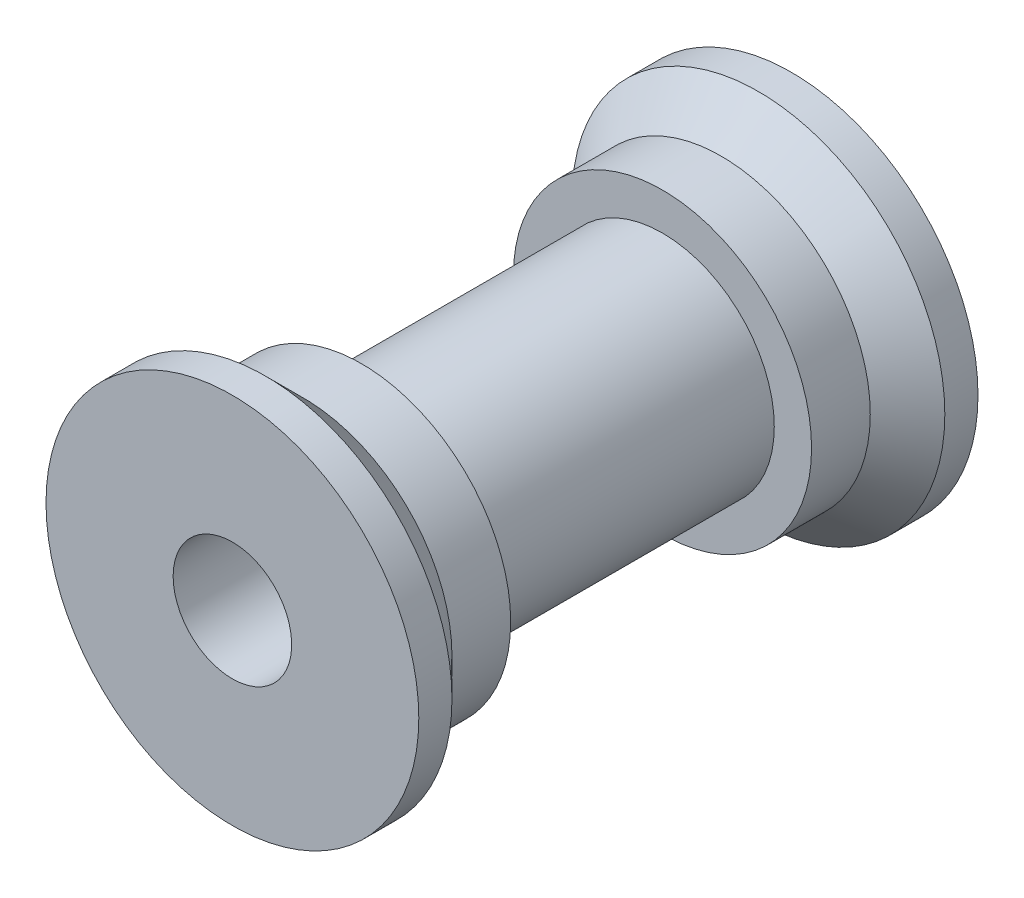
from build123d import *

# Parameters (mm, degrees)
SKETCH1_R           = 12.7
SKETCH1_R_2         = 4.0386
BOSS_EXTRUDE1_DEPTH = 38.1


with BuildPart() as part:
    # Sketch1 → Boss-Extrude1 (new body)
    with BuildSketch(Plane.XY):
        with Locations(Location((0, 0, 0), (0, 0, 180))):
            Circle(SKETCH1_R)
        with Locations(Location((0, 0, 0), (0, 0, 180))):
            Circle(SKETCH1_R_2, mode=Mode.SUBTRACT)
    extrude(amount=BOSS_EXTRUDE1_DEPTH)

    # Sketch2 → Cut-Revolve1 (revolve, cut)
    with BuildSketch(Plane(origin=(0, 0, 0), x_dir=(1, 0, 0), z_dir=(0, 1, 0)), mode=Mode.PRIVATE) as cut_revolve1_sk:
        Polygon((10.16, -33.3), (12.7, -35.84), (12.7, -2.26), (10.16, -4.8), (10.16, -8.8), (7.62, -8.8), (7.62, -29.3), (10.16, -29.3), align=None)
    revolve(cut_revolve1_sk.sketch.rotate(Axis((0, 0, 0), (0, 0, 1)), 180), axis=Axis((0, 0, 0), (0, 0, 1)), mode=Mode.SUBTRACT)


solid = part.part
